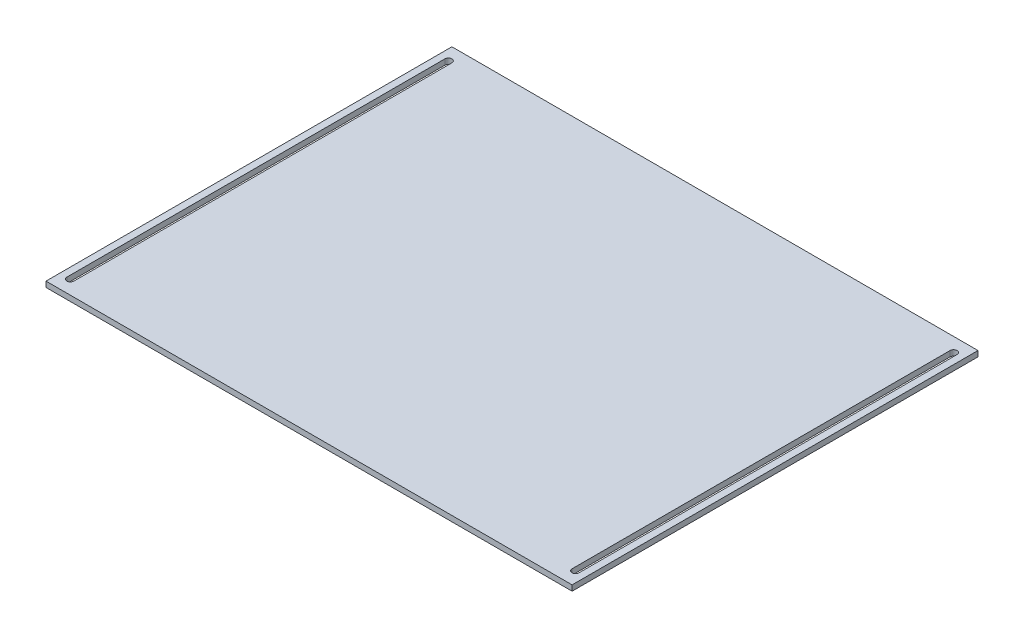
from build123d import *

# Parameters (mm, degrees)
SKETCH1_W           = 302
SKETCH1_H           = 233
BOSS_EXTRUDE1_DEPTH = 3.175
CUT_EXTRUDE1_DEPTH  = 382.448660536


with BuildPart() as part:
    # Sketch1 → Boss-Extrude1 (new body)
    with BuildSketch(Plane(origin=(0, 0, 0), x_dir=(1, 0, 0), z_dir=(0, 1, 0))):
        with Locations((-151, 116.5)):
            Rectangle(SKETCH1_W, SKETCH1_H)
    extrude(amount=BOSS_EXTRUDE1_DEPTH)

    # Sketch2 → Cut-Extrude1 (cut, through all)
    with BuildSketch(Plane(origin=(0, 3.175, 0), x_dir=(1, 0, 0), z_dir=(0, 1, 0))):
        with BuildLine():
            Line((-294, 225), (-294, 8))
            ThreePointArc((-294, 8), (-296, 6), (-298, 8))
            Line((-298, 8), (-298, 225))
            ThreePointArc((-298, 225), (-296, 227), (-294, 225))
        make_face()
        with BuildLine():
            Line((-4, 225), (-4, 8))
            ThreePointArc((-4, 8), (-6, 6), (-8, 8))
            Line((-8, 8), (-8, 225))
            ThreePointArc((-8, 225), (-6, 227), (-4, 225))
        make_face()
    extrude(amount=-CUT_EXTRUDE1_DEPTH, mode=Mode.SUBTRACT)


solid = part.part
